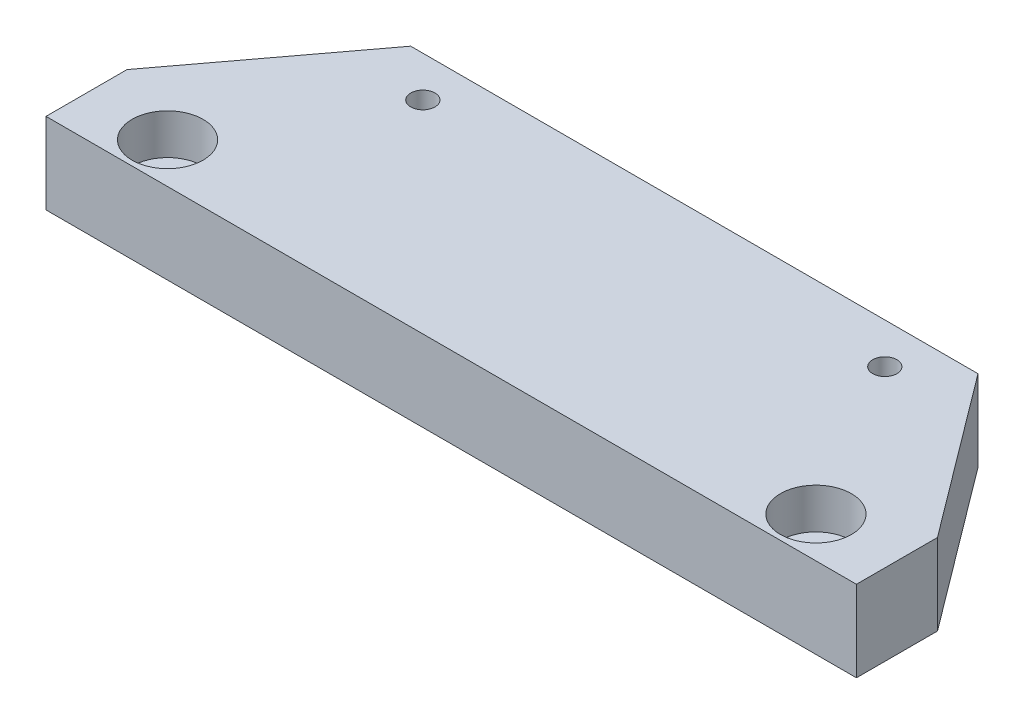
from build123d import *

# Parameters (mm, degrees)
BOSS_EXTRUDE3_DEPTH                              = 12.7
CBORE_FOR_6_SOCKET_HEAD_CAP_SCREW1_D             = 3.7973
CBORE_FOR_6_SOCKET_HEAD_CAP_SCREW1_CBORE_D       = 7.14502
CBORE_FOR_6_SOCKET_HEAD_CAP_SCREW1_CBORE_DEPTH   = 3.5052
CBORE_FOR_1_4_SOCKET_HEAD_CAP_SCREW1_D           = 6.7564
CBORE_FOR_1_4_SOCKET_HEAD_CAP_SCREW1_CBORE_D     = 11.1125
CBORE_FOR_1_4_SOCKET_HEAD_CAP_SCREW1_CBORE_DEPTH = 6.35


with BuildPart() as part:
    # Sketch8 → Boss-Extrude3 (new body)
    with BuildSketch(Plane(origin=(0, 0, 0), x_dir=(1, 0, 0), z_dir=(0, 1, 0))):
        Polygon((0, 0), (88.9, 0), (107.95, -25.4), (107.95, -38.1), (-19.05, -38.1), (-19.05, -25.4), align=None)
    extrude(amount=BOSS_EXTRUDE3_DEPTH)

    # CBORE for #6 Socket Head Cap Screw1 (through all)
    with Locations(Plane(origin=(0, 0, 0), x_dir=(-1, 0, 0), z_dir=(0, -1, 0))):
        with Locations((-80.645, -6.35), (-8.255, -6.35)):
            CounterBoreHole(CBORE_FOR_6_SOCKET_HEAD_CAP_SCREW1_D / 2, CBORE_FOR_6_SOCKET_HEAD_CAP_SCREW1_CBORE_D / 2, CBORE_FOR_6_SOCKET_HEAD_CAP_SCREW1_CBORE_DEPTH)

    # CBORE for 1/4 Socket Head Cap Screw1 (through all)
    with Locations(Plane(origin=(0, 12.7, 0), x_dir=(1, 0, 0), z_dir=(0, 1, 0))):
        with Locations((-6.35, -31.75), (95.25, -31.75)):
            CounterBoreHole(CBORE_FOR_1_4_SOCKET_HEAD_CAP_SCREW1_D / 2, CBORE_FOR_1_4_SOCKET_HEAD_CAP_SCREW1_CBORE_D / 2, CBORE_FOR_1_4_SOCKET_HEAD_CAP_SCREW1_CBORE_DEPTH)


solid = part.part
